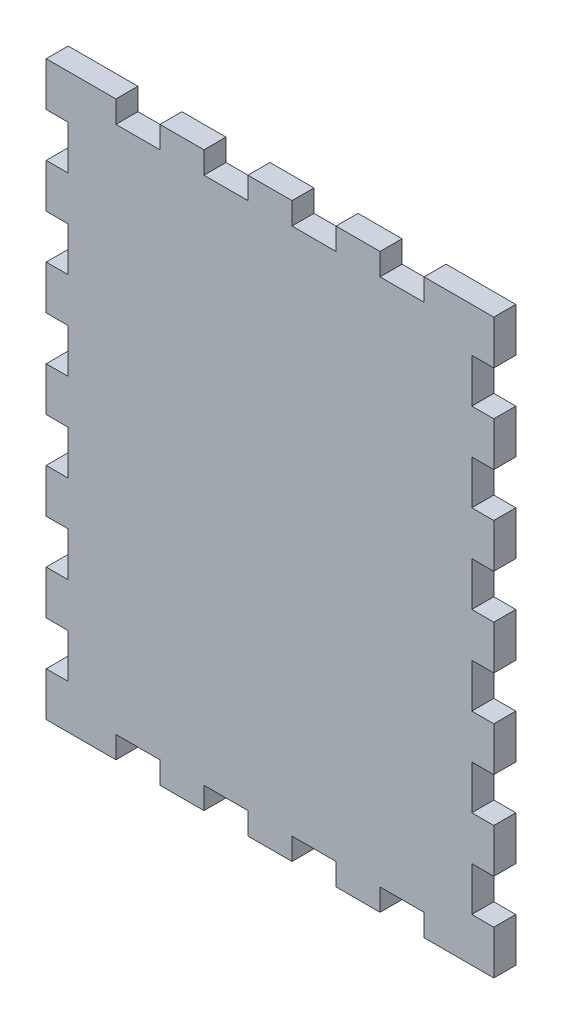
from build123d import *

# Parameters (mm, degrees)
EXTRUDE_1_DEPTH = 3


with BuildPart() as part:
    # 草图2 → 凸台-拉伸1 (new body)
    with BuildSketch(Plane.XY):
        Polygon((0, 81), (0, 75), (3, 75), (3, 69), (0, 69), (0, 63), (3, 63), (3, 57), (0, 57), (0, 51), (3, 51), (3, 45), (0, 45), (0, 39), (3, 39), (3, 33), (0, 33), (0, 27), (3, 27), (3, 21), (0, 21), (0, 15), (3, 15), (3, 9), (0, 9), (0, 3), (9.5, 3), (9.5, 6), (15.5, 6), (15.5, 3), (21.5, 3), (21.5, 6), (27.5, 6), (27.5, 3), (33.5, 3), (33.5, 6), (39.5, 6), (39.5, 3), (45.5, 3), (45.5, 6), (51.5, 6), (51.5, 3), (57.5, 3), (61, 3), (61, 9), (58, 9), (58, 15), (61, 15), (61, 21), (58, 21), (58, 27), (61, 27), (61, 33), (58, 33), (58, 39), (61, 39), (61, 45), (58, 45), (58, 51), (61, 51), (61, 57), (58, 57), (58, 63), (61, 63), (61, 69), (58, 69), (58, 75), (61, 75), (61, 81), (51.5, 81), (51.5, 78), (45.5, 78), (45.5, 81), (39.5, 81), (39.5, 78), (33.5, 78), (33.5, 81), (27.5, 81), (27.5, 78), (21.5, 78), (21.5, 81), (15.5, 81), (15.5, 78), (9.5, 78), (9.5, 81), (3.5, 81), align=None)
    extrude(amount=EXTRUDE_1_DEPTH)


solid = part.part
